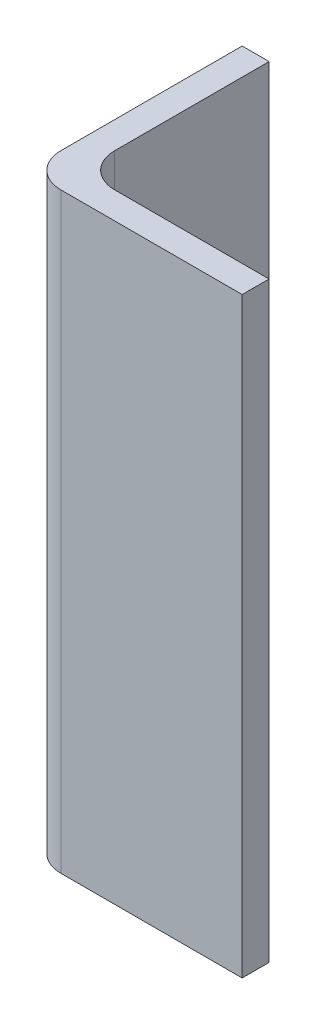
from build123d import *

# Parameters (mm, degrees)
BOSS_EXTRUDE1_DEPTH = 34.925
FILLET1_R           = 2
FILLET2_R           = 2


with BuildPart() as part:
    # Sketch1 → Boss-Extrude1 (new body)
    with BuildSketch(Plane(origin=(0, 0, 0), x_dir=(1, 0, 0), z_dir=(0, 1, 0))):
        Polygon((-7.943330105, 9.7977882), (-6.353330105, 9.7977882), (-6.353330105, -1.3147118), (4.756669895, -1.3147118), (4.756669895, -2.9022118), (-6.353330105, -2.9022118), (-7.943330105, -2.9022118), align=None)
    extrude(amount=BOSS_EXTRUDE1_DEPTH)

    # Fillet1
    fillet1_edges = [part.edges().sort_by_distance(p)[0] for p in [
        (-6.353330105, 17.4625, 1.3147118),
    ]]
    fillet(fillet1_edges, radius=FILLET1_R)

    # Fillet2
    fillet2_edges = [part.edges().sort_by_distance(p)[0] for p in [
        (-7.943330105, 17.4625, 2.9022118),
    ]]
    fillet(fillet2_edges, radius=FILLET2_R)


solid = part.part
